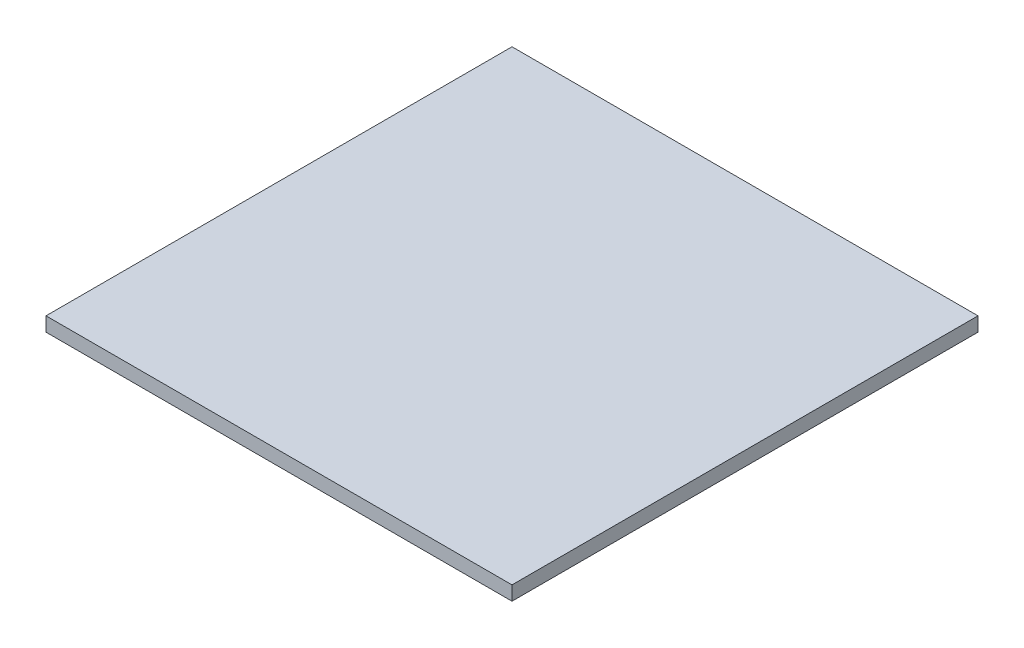
from build123d import *

# Parameters (mm, degrees)
SKETCH1_W           = 526
SKETCH1_H           = 526
BOSS_EXTRUDE1_DEPTH = 16


with BuildPart() as part:
    # Sketch1 → Boss-Extrude1 (new body)
    with BuildSketch(Plane(origin=(0, 0, 0), x_dir=(1, 0, 0), z_dir=(0, 1, 0))):
        with Locations((0, -263)):
            Rectangle(SKETCH1_W, SKETCH1_H)
    extrude(amount=BOSS_EXTRUDE1_DEPTH)


solid = part.part
